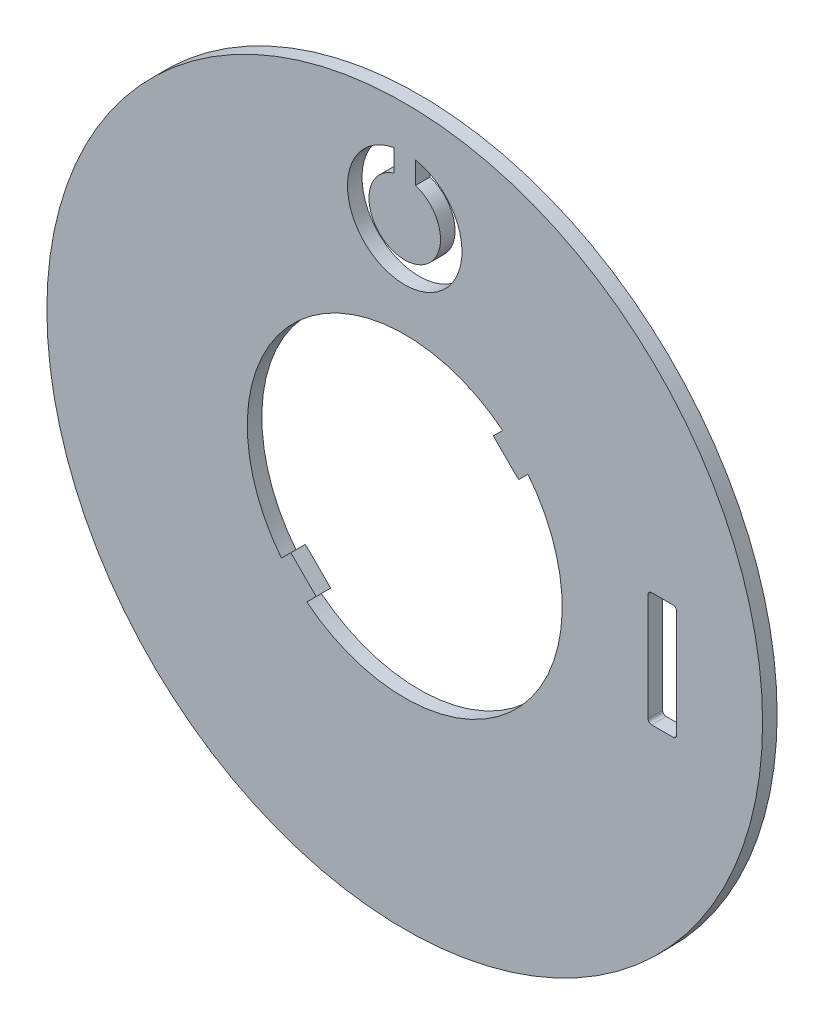
from build123d import *

# Parameters (mm, degrees)
SKETCH1_R           = 25
BOSS_EXTRUDE1_DEPTH = 1.016
CUT_EXTRUDE1_DEPTH  = 158.985038077


with BuildPart() as part:
    # Sketch1 → Boss-Extrude1 (new body)
    with BuildSketch(Plane.XY):
        with Locations((107.000000001, 61.8)):
            Circle(SKETCH1_R)
        with BuildLine():
            Line((113.843907282, 70.411674235), (113.187184336, 69.754951288))
            Line((113.187184336, 69.754951288), (114.954951289, 67.987184335))
            Line((114.954951289, 67.987184335), (115.611674235, 68.643907282))
            ThreePointArc((115.611674235, 68.643907282), (114.778174594, 54.021825407), (100.156092719, 53.188325765))
            Line((100.156092719, 53.188325765), (100.812815665, 53.845048712))
            Line((100.812815665, 53.845048712), (99.045048712, 55.612815665))
            Line((99.045048712, 55.612815665), (98.388325766, 54.956092718))
            ThreePointArc((98.388325766, 54.956092718), (99.221825408, 69.578174593), (113.843907282, 70.411674235))
        make_face(mode=Mode.SUBTRACT)
    extrude(amount=BOSS_EXTRUDE1_DEPTH)

    # Sketch2 → Cut-Extrude1 (cut, through all)
    with BuildSketch(Plane.XY):
        with BuildLine():
            ThreePointArc((106.250000001, 82.184848004), (107.000000001, 77.3), (107.750000001, 82.184848004))
            Line((107.750000001, 82.184848004), (107.750000001, 83.729058411))
            ThreePointArc((107.750000001, 83.729058411), (107.000000001, 75.8), (106.250000001, 83.729058411))
            Line((106.250000001, 83.729058411), (106.250000001, 82.184848004))
        make_face()
        with BuildLine():
            ThreePointArc((124.000000001, 65.55), (124.073223305, 65.726776695), (124.250000001, 65.8))
            Line((124.250000001, 65.8), (125.750000001, 65.8))
            ThreePointArc((125.750000001, 65.8), (125.926776696, 65.726776695), (126.000000001, 65.55))
            Line((126.000000001, 65.55), (126.000000001, 58.05))
            ThreePointArc((126.000000001, 58.05), (125.926776696, 57.873223305), (125.750000001, 57.8))
            Line((125.750000001, 57.8), (124.250000001, 57.8))
            ThreePointArc((124.250000001, 57.8), (124.073223305, 57.873223305), (124.000000001, 58.05))
            Line((124.000000001, 58.05), (124.000000001, 65.55))
        make_face()
    extrude(amount=CUT_EXTRUDE1_DEPTH, mode=Mode.SUBTRACT)


solid = part.part
